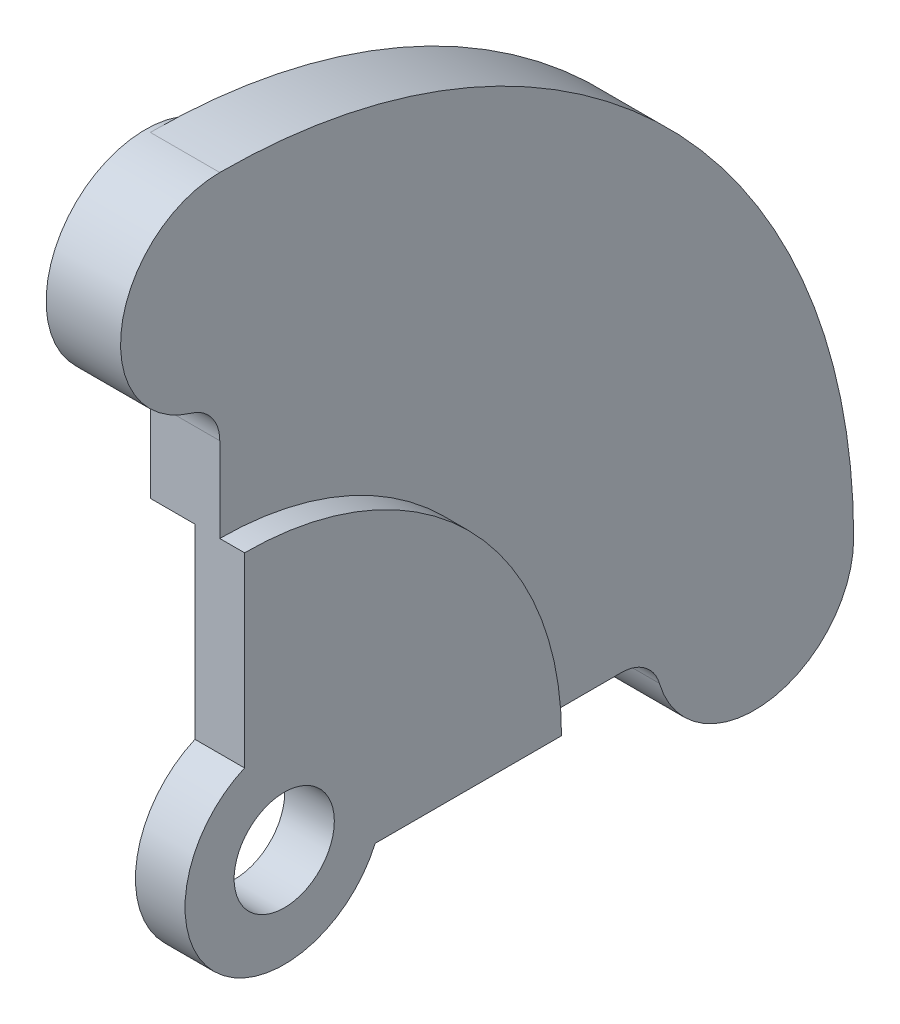
from build123d import *

# Parameters (mm, degrees)
SALIENTE_EXTRUIR1_DEPTH = 2.5
SALIENTE_EXTRUIR2_DEPTH = 7
CROQUIS2_4_R            = 10
SALIENTE_EXTRUIR3_DEPTH = 7.5
REDONDEO1_R             = 4
REDONDEO2_R             = 4
CROQUIS3_R              = 10
SALIENTE_EXTRUIR4_DEPTH = 5
CROQUIS4_R              = 5.05
CORTAR_EXTRUIR1_DEPTH   = 131


with BuildPart() as part:
    # Croquis2 → Saliente-Extruir1 (new, symmetric)
    with BuildSketch(Plane(origin=(0, 0, 0), x_dir=(0, 0, -1), z_dir=(1, 0, 0))):
        with BuildLine():
            ThreePointArc((31.95, 0), (22.592061659, 22.592061659), (0, 31.95))
            Line((0, 31.95), (0, 0))
            Line((0, 0), (31.95, 0))
        make_face()
    extrude(amount=SALIENTE_EXTRUIR1_DEPTH, both=True)

    # Croquis2<3> → Saliente-Extruir2 (add)
    with BuildSketch(Plane(origin=(0, 0, 0), x_dir=(0, 0, -1), z_dir=(1, 0, 0))):
        with BuildLine():
            ThreePointArc((10, 53.9), (7.071067812, 46.828932188), (0, 43.9))
            Line((0, 43.9), (0, 31.95))
            ThreePointArc((0, 31.95), (22.592061659, 22.592061659), (31.95, 0))
            Line((31.95, 0), (43.9, 0))
            ThreePointArc((43.9, 0), (53.9, 10), (63.9, 0))
            ThreePointArc((63.9, 0), (45.184123318, 45.184123318), (0, 63.9))
            ThreePointArc((0, 63.9), (7.071067812, 60.971067812), (10, 53.9))
        make_face()
    extrude(amount=-SALIENTE_EXTRUIR2_DEPTH)

    # Croquis2<4> → Saliente-Extruir3 (add)
    with BuildSketch(Plane(origin=(0, 0, 0), x_dir=(0, 0, -1), z_dir=(1, 0, 0))):
        with Locations((0, 53.9)):
            Circle(CROQUIS2_4_R)
        with Locations((53.9, 0)):
            Circle(CROQUIS2_4_R)
    extrude(amount=-SALIENTE_EXTRUIR3_DEPTH)

    # Redondeo1
    redondeo1_edges = [part.edges().sort_by_distance(p)[0] for p in [
        (0, 0, 0),
    ]]
    fillet(redondeo1_edges, radius=REDONDEO1_R)

    # Redondeo2
    redondeo2_edges = [part.edges().sort_by_distance(p)[0] for p in [
        (-3.5, 43.9, 0),
        (-3.5, 0, -43.9),
    ]]
    fillet(redondeo2_edges, radius=REDONDEO2_R)

    # Croquis3 → Saliente-Extruir4 (add)
    with BuildSketch(Plane(origin=(2.5, 0, 0), x_dir=(0, 0, -1), z_dir=(1, 0, 0))):
        with Locations((4, 4)):
            Circle(CROQUIS3_R)
    extrude(amount=-SALIENTE_EXTRUIR4_DEPTH)

    # Croquis4 → Cortar-Extruir1 (cut)
    with BuildSketch(Plane(origin=(2.5, 0, 0), x_dir=(0, 0, -1), z_dir=(1, 0, 0))):
        with Locations((4, 4)):
            Circle(CROQUIS4_R)
    extrude(amount=-CORTAR_EXTRUIR1_DEPTH, mode=Mode.SUBTRACT)


solid = part.part
